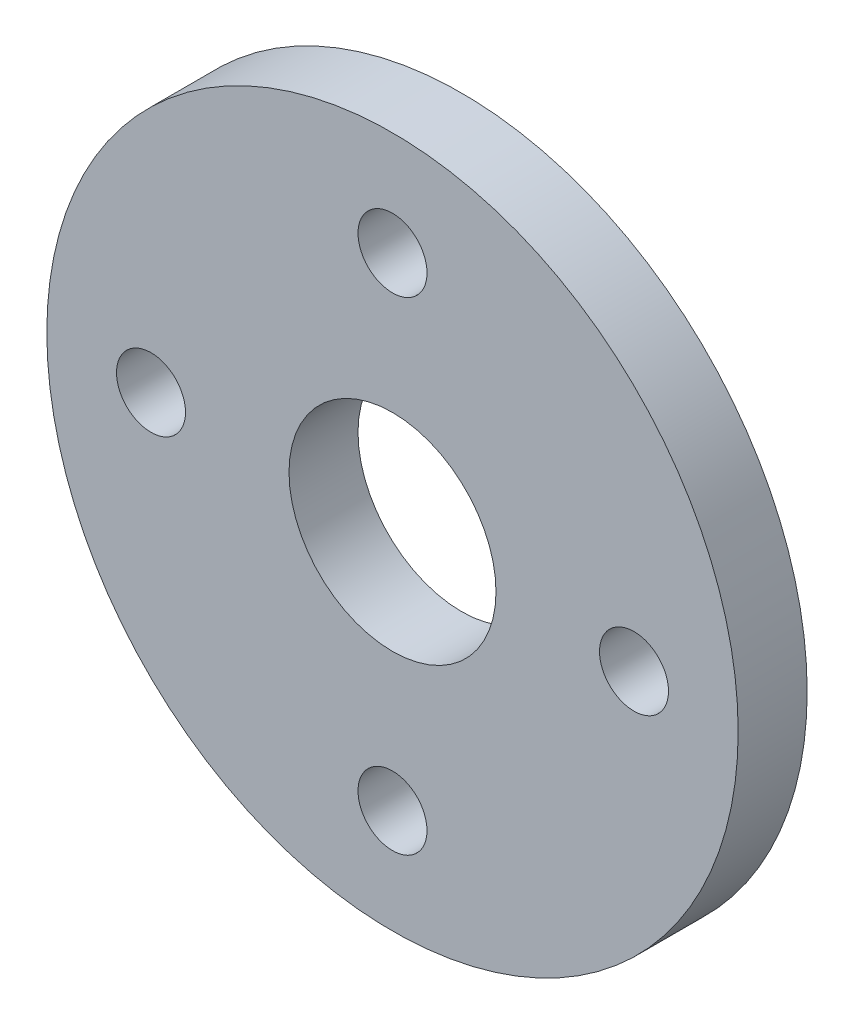
from build123d import *

# Parameters (mm, degrees)
SKETCH1_R           = 10.02
SKETCH1_R_2         = 3
SKETCH1_R_3         = 1
BOSS_EXTRUDE1_DEPTH = 2


with BuildPart() as part:
    # Sketch1 → Boss-Extrude1 (new body)
    with BuildSketch(Plane.XY):
        Circle(SKETCH1_R)
        Circle(SKETCH1_R_2, mode=Mode.SUBTRACT)
        with Locations((0, 7)):
            Circle(SKETCH1_R_3, mode=Mode.SUBTRACT)
        with Locations((7, 0)):
            Circle(SKETCH1_R_3, mode=Mode.SUBTRACT)
        with Locations((0, -7)):
            Circle(SKETCH1_R_3, mode=Mode.SUBTRACT)
        with Locations((-7, 0)):
            Circle(SKETCH1_R_3, mode=Mode.SUBTRACT)
    extrude(amount=BOSS_EXTRUDE1_DEPTH)


solid = part.part
